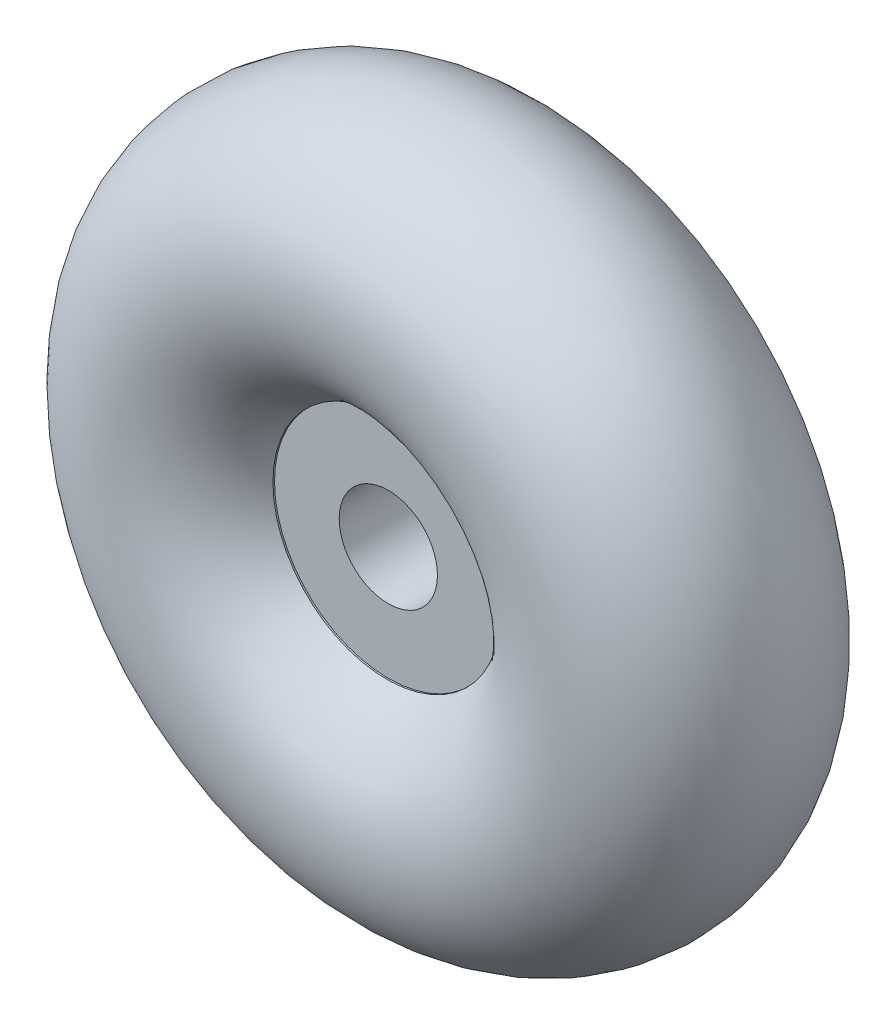
from build123d import *

# Parameters (mm, degrees)
SKETCH_1_R          = 10
EXTRUDE_1_DEPTH     = 10
SKETCH_2_W          = 1
SKETCH_2_H          = 10
SKETCH_3_R          = 4.1
CUT_EXTRUDE_1_DEPTH = 45.055542737


with BuildPart() as part:
    # Эскиз1 → Бобышка-Вытянуть1 (new body)
    with BuildSketch(Plane.XY):
        Circle(SKETCH_1_R)
    extrude(amount=EXTRUDE_1_DEPTH)

    # Эскиз2 → Повернуть-Тонкостенный1 (revolve)
    with BuildSketch(Plane(origin=(0, 0, 0), x_dir=(1, 0, 0), z_dir=(0, 1, 0)), mode=Mode.PRIVATE) as revolve_1_sk:
        with BuildLine():
            Line((9.5, 0.132226219), (9.5, -10.132226219))
            ThreePointArc((9.5, -10.132226219), (29.160254038, -5), (9.5, 0.132226219))
        make_face()
        with BuildLine():
            Line((10.5, -0.135819284), (10.5, -9.864180716))
            ThreePointArc((10.5, -9.864180716), (28.160254038, -5), (10.5, -0.135819284))
        make_face(mode=Mode.SUBTRACT)
        with Locations((-10, -5)):
            Rectangle(SKETCH_2_W, SKETCH_2_H)
    revolve(revolve_1_sk.sketch.rotate(Axis((0, 0, 0), (0, 0, 1)), 180), axis=Axis((0, 0, 0), (0, 0, 1)))

    # Эскиз3 → Вырез-Вытянуть1 (cut, through all)
    with BuildSketch(Plane(origin=(0, 0, 0), x_dir=(-1, 0, 0), z_dir=(0, 0, -1))):
        Circle(SKETCH_3_R)
    extrude(amount=-CUT_EXTRUDE_1_DEPTH, mode=Mode.SUBTRACT)


solid = part.part
